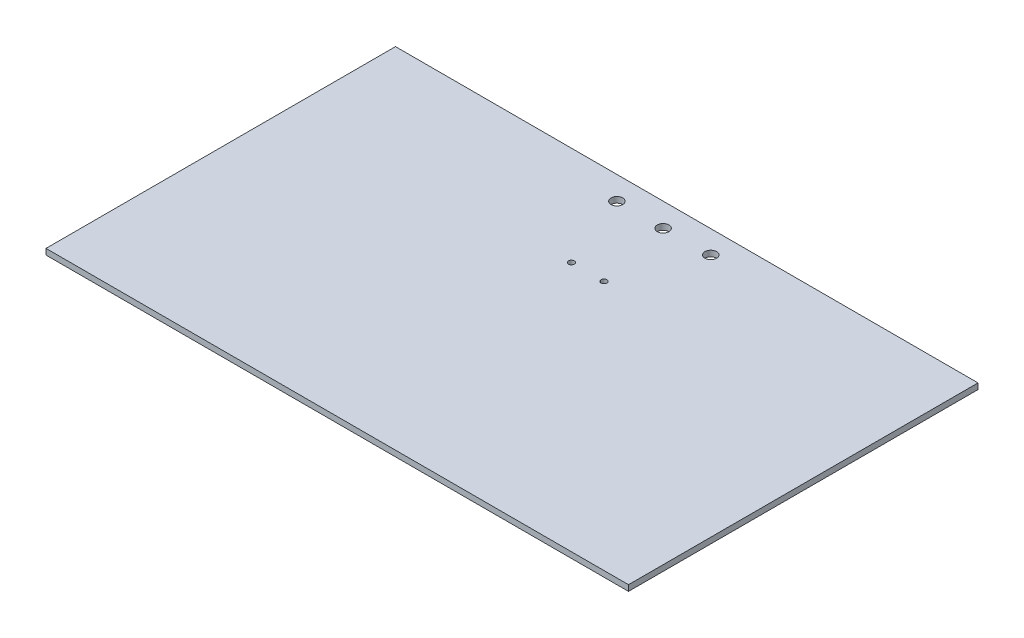
from build123d import *

# Parameters (mm, degrees)
SKETCH2_W               = 500
SKETCH2_H               = 300
BOSS_EXTRUDE1_DEPTH     = 5
CUT_EXTRUDE1_DEPTH      = 292.590466236
CUT_EXTRUDE1_DEPTH_BACK = 292.590466236
SKETCH3_R               = 5
CUT_EXTRUDE2_DEPTH      = 292.590466236
CUT_EXTRUDE2_DEPTH_BACK = 292.590466236
SKETCH4_R               = 5
SKETCH5_R               = 2.5
CUT_EXTRUDE3_DEPTH      = 292.590466236


with BuildPart() as part:
    # Sketch2 → Boss-Extrude1 (new body)
    with BuildSketch(Plane(origin=(0, 0, 0), x_dir=(1, 0, 0), z_dir=(0, 1, 0))):
        Rectangle(SKETCH2_W, SKETCH2_H)
    extrude(amount=BOSS_EXTRUDE1_DEPTH)

    # Sketch3 → Cut-Extrude1 (cut, two sides: drawn at the far end of the back side and taken through both)
    with BuildSketch(Plane.XZ.offset(-CUT_EXTRUDE1_DEPTH_BACK)):
        with Locations(Location((-40.044249933, -130.077128907, 0), (0, 0, 270))):
            Circle(SKETCH3_R)
        with Locations(Location((-0.071386653, -129.777985414, 0), (0, 0, 270))):
            Circle(SKETCH3_R)
    extrude(amount=CUT_EXTRUDE1_DEPTH + CUT_EXTRUDE1_DEPTH_BACK, mode=Mode.SUBTRACT)

    # Sketch4 → Cut-Extrude2 (cut, two sides: drawn at the far end of the back side and taken through both)
    with BuildSketch(Plane(origin=(0, 5, 0), x_dir=(1, 0, 0), z_dir=(0, 1, 0)).offset(-CUT_EXTRUDE2_DEPTH_BACK)):
        with Locations(Location((40.196351758, 130.448547008, 0), (0, 0, 270))):
            Circle(SKETCH4_R)
    extrude(amount=CUT_EXTRUDE2_DEPTH + CUT_EXTRUDE2_DEPTH_BACK, mode=Mode.SUBTRACT)

    # Sketch5 → Cut-Extrude3 (cut, through all)
    with BuildSketch(Plane(origin=(0, 5, 0), x_dir=(1, 0, 0), z_dir=(0, 1, 0))):
        with Locations(Location((14, 65, 0), (0, 0, 270))):
            Circle(SKETCH5_R)
        with Locations(Location((-14, 65, 0), (0, 0, 270))):
            Circle(SKETCH5_R)
    extrude(amount=-CUT_EXTRUDE3_DEPTH, mode=Mode.SUBTRACT)


solid = part.part
